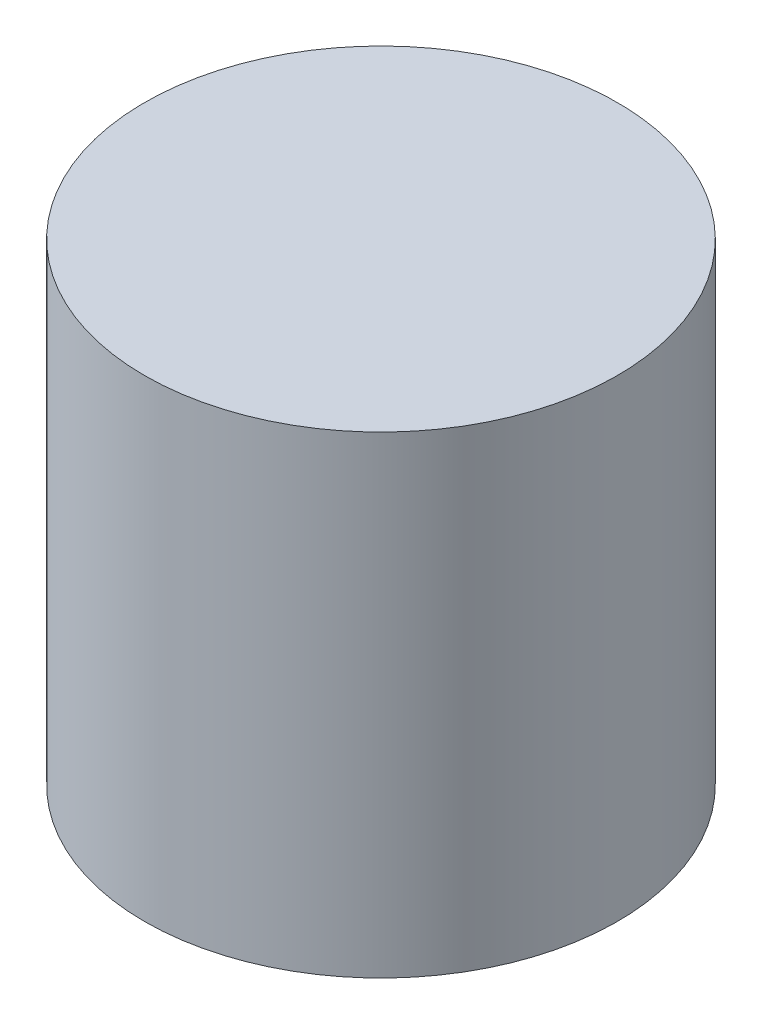
from build123d import *

# Parameters (mm, degrees)
SKETCH2_R           = 25.4
BOSS_EXTRUDE1_DEPTH = 50.8


with BuildPart() as part:
    # Sketch2 → Boss-Extrude1 (new body)
    with BuildSketch(Plane(origin=(0, 0, 0), x_dir=(1, 0, 0), z_dir=(0, 1, 0))):
        with Locations(Location((0, 0, 0), (0, 0, 270))):
            Circle(SKETCH2_R)
    extrude(amount=BOSS_EXTRUDE1_DEPTH)


solid = part.part
